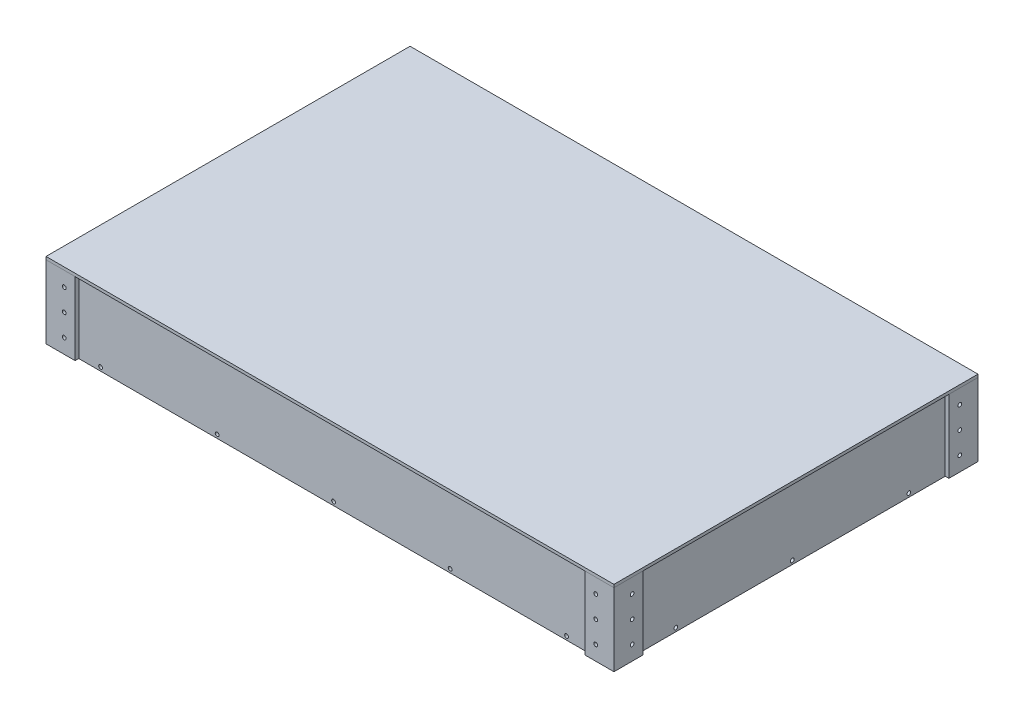
from build123d import *

# Parameters (mm, degrees)
SKETCH1_W                  = 482.6
SKETCH1_H                  = 304.8
BOSS_EXTRUDE1_DEPTH        = 6.35
BOSS_EXTRUDE2_DEPTH        = 57.15
BOSS_EXTRUDE2_DEPTH_BACK   = 6.35
SKETCH2_W                  = 482.6
SKETCH2_H                  = 3.175
BOSS_EXTRUDE2_2_DEPTH      = 57.15
BOSS_EXTRUDE2_2_DEPTH_BACK = 6.35
BOSS_EXTRUDE3_START        = -6.35
SKETCH3_W                  = 3.175
SKETCH3_H                  = 311.15
BOSS_EXTRUDE3_DEPTH        = 63.5
BOSS_EXTRUDE3_2_DEPTH      = 63.5
BOSS_EXTRUDE4_DEPTH        = 63.5
SKETCH5_R                  = 1.651
CUT_EXTRUDE1_DEPTH         = 406.170307556
SKETCH6_R                  = 1.651
CUT_EXTRUDE2_DEPTH         = 524.980822645
CUT_EXTRUDE3_DEPTH         = 406.170307556
CUT_EXTRUDE3_DEPTH_BACK    = 406.170307556
SKETCH7_R                  = 1.651
SKETCH8_R                  = 1.651
CUT_EXTRUDE4_DEPTH         = 521.980640835
SKETCH9_W                  = 495.3
SKETCH9_H                  = 317.5
BOSS_EXTRUDE5_DEPTH        = 2.54


with BuildPart() as part:
    # Sketch1 → Boss-Extrude1 (new body)
    with BuildSketch(Plane(origin=(0, 0, 0), x_dir=(1, 0, 0), z_dir=(0, 1, 0))):
        Rectangle(SKETCH1_W, SKETCH1_H)
    extrude(amount=BOSS_EXTRUDE1_DEPTH)


with BuildPart() as body_2:
    # Sketch2 → Boss-Extrude2 (new, two sides: drawn at the far end of the back side and taken through both)
    with BuildSketch(Plane(origin=(0, 6.35, 0), x_dir=(1, 0, 0), z_dir=(0, 1, 0)).offset(-BOSS_EXTRUDE2_DEPTH_BACK)):
        with Locations((0, 153.9875)):
            Rectangle(SKETCH2_W, SKETCH2_H)
    extrude(amount=BOSS_EXTRUDE2_DEPTH + BOSS_EXTRUDE2_DEPTH_BACK)


with BuildPart() as body_3:
    # Sketch2 → Boss-Extrude2 2 (new, two sides: drawn at the far end of the back side and taken through both)
    with BuildSketch(Plane(origin=(0, 6.35, 0), x_dir=(1, 0, 0), z_dir=(0, 1, 0)).offset(-BOSS_EXTRUDE2_2_DEPTH_BACK)):
        with Locations((0, -153.9875)):
            Rectangle(SKETCH2_W, SKETCH2_H)
    extrude(amount=BOSS_EXTRUDE2_2_DEPTH + BOSS_EXTRUDE2_2_DEPTH_BACK)


with BuildPart() as body_4:
    # Sketch3 → Boss-Extrude3 (new body)
    with BuildSketch(Plane(origin=(0, 6.35, 0), x_dir=(1, 0, 0), z_dir=(0, 1, 0)).offset(BOSS_EXTRUDE3_START)):
        with Locations((-242.8875, 0)):
            Rectangle(SKETCH3_W, SKETCH3_H)
    extrude(amount=BOSS_EXTRUDE3_DEPTH)


with BuildPart() as body_5:
    # Sketch3 → Boss-Extrude3 2 (new body)
    with BuildSketch(Plane(origin=(0, 6.35, 0), x_dir=(1, 0, 0), z_dir=(0, 1, 0)).offset(BOSS_EXTRUDE3_START)):
        with Locations((242.8875, 0)):
            Rectangle(SKETCH3_W, SKETCH3_H)
    extrude(amount=BOSS_EXTRUDE3_2_DEPTH)


with BuildPart() as body_6:
    # Sketch4 → Boss-Extrude4 (new body)
    with BuildSketch(Plane.XZ):
        Polygon((-244.475, -155.575), (-222.25, -155.575), (-222.25, -158.75), (-247.65, -158.75), (-247.65, -133.35), (-244.475, -133.35), align=None)
    extrude(amount=-BOSS_EXTRUDE4_DEPTH)


with BuildPart() as body_7:
    # Mirror1: mirrored copy
    add(body_6.part.mirror(Plane(origin=(0, 0, 0), x_dir=(0, 0, 1), z_dir=(1, 0, 0))))


with BuildPart() as body_8:
    # Mirror2: mirrored copy
    add(body_6.part.mirror(Plane.XY))


with BuildPart() as body_9:
    # Mirror2 2: mirrored copy
    add(body_7.part.mirror(Plane.XY))


with BuildPart() as cut_extrude1_tool:
    # Sketch5 → Cut-Extrude1 (new, through all)
    with BuildSketch(Plane(origin=(0, 0, -155.575), x_dir=(-1, 0, 0), z_dir=(0, 0, -1))):
        with Locations((-231.775, 50.8)):
            Circle(SKETCH5_R)
        with Locations((-231.775, 31.75)):
            Circle(SKETCH5_R)
        with Locations((-231.775, 12.7)):
            Circle(SKETCH5_R)
    cut_extrude1 = extrude(amount=-CUT_EXTRUDE1_DEPTH)


with BuildPart() as body_2_1:
    add(body_2.part)

    # Cut-Extrude1: cut by cut_extrude1_tool
    add(cut_extrude1_tool.part, mode=Mode.SUBTRACT)


with BuildPart() as body_3_1:
    add(body_3.part)

    # Cut-Extrude1: cut by cut_extrude1_tool
    add(cut_extrude1_tool.part, mode=Mode.SUBTRACT)


with BuildPart() as body_9_1:
    add(body_9.part)

    # Cut-Extrude1: cut by cut_extrude1_tool
    add(cut_extrude1_tool.part, mode=Mode.SUBTRACT)


with BuildPart() as mirror3_tool:
    # Mirror3: Cut-Extrude1 across plane
    add(cut_extrude1.mirror(Plane(origin=(0, 0, 0), x_dir=(0, 0, 1), z_dir=(1, 0, 0))))


with BuildPart() as body_2_2:
    add(body_2_1.part)

    # Mirror3: cut by mirror3_tool
    add(mirror3_tool.part, mode=Mode.SUBTRACT)


with BuildPart() as body_3_2:
    add(body_3_1.part)

    # Mirror3: cut by mirror3_tool
    add(mirror3_tool.part, mode=Mode.SUBTRACT)


with BuildPart() as body_8_1:
    add(body_8.part)

    # Mirror3: cut by mirror3_tool
    add(mirror3_tool.part, mode=Mode.SUBTRACT)


with BuildPart() as cut_extrude2_tool:
    # Sketch6 → Cut-Extrude2 (new, through all)
    with BuildSketch(Plane.ZY.offset(247.65)):
        with Locations((-142.875, 50.8)):
            Circle(SKETCH6_R)
        with Locations((-142.875, 31.75)):
            Circle(SKETCH6_R)
        with Locations((-142.875, 12.7)):
            Circle(SKETCH6_R)
    cut_extrude2 = extrude(amount=-CUT_EXTRUDE2_DEPTH)


with BuildPart() as body_4_1:
    add(body_4.part)

    # Cut-Extrude2: cut by cut_extrude2_tool
    add(cut_extrude2_tool.part, mode=Mode.SUBTRACT)


with BuildPart() as body_5_1:
    add(body_5.part)

    # Cut-Extrude2: cut by cut_extrude2_tool
    add(cut_extrude2_tool.part, mode=Mode.SUBTRACT)


with BuildPart() as body_6_1:
    add(body_6.part)

    # Cut-Extrude2: cut by cut_extrude2_tool
    add(cut_extrude2_tool.part, mode=Mode.SUBTRACT)


with BuildPart() as body_7_1:
    add(body_7.part)

    # Cut-Extrude2: cut by cut_extrude2_tool
    add(cut_extrude2_tool.part, mode=Mode.SUBTRACT)


with BuildPart() as mirror4_tool:
    # Mirror4: Cut-Extrude2 across plane
    add(cut_extrude2.mirror(Plane.XY))


with BuildPart() as body_4_2:
    add(body_4_1.part)

    # Mirror4: cut by mirror4_tool
    add(mirror4_tool.part, mode=Mode.SUBTRACT)


with BuildPart() as body_5_2:
    add(body_5_1.part)

    # Mirror4: cut by mirror4_tool
    add(mirror4_tool.part, mode=Mode.SUBTRACT)


with BuildPart() as body_8_2:
    add(body_8_1.part)

    # Mirror4: cut by mirror4_tool
    add(mirror4_tool.part, mode=Mode.SUBTRACT)


with BuildPart() as body_9_2:
    add(body_9_1.part)

    # Mirror4: cut by mirror4_tool
    add(mirror4_tool.part, mode=Mode.SUBTRACT)


with BuildPart() as cut_extrude3_tool:
    # Sketch7 → Cut-Extrude3 (new, two sides: drawn at the far end of the back side and taken through both)
    with BuildSketch(Plane.XY.offset(155.575).offset(-CUT_EXTRUDE3_DEPTH_BACK)):
        with Locations((-203.2, 3.175)):
            Circle(SKETCH7_R)
        with Locations((0, 3.175)):
            Circle(SKETCH7_R)
        with Locations((203.2, 3.175)):
            Circle(SKETCH7_R)
        with Locations((101.6, 3.175)):
            Circle(SKETCH7_R)
        with Locations((-101.6, 3.175)):
            Circle(SKETCH7_R)
    extrude(amount=CUT_EXTRUDE3_DEPTH + CUT_EXTRUDE3_DEPTH_BACK)


with BuildPart() as body_3_3:
    add(body_3_2.part)

    # Cut-Extrude3: cut by cut_extrude3_tool
    add(cut_extrude3_tool.part, mode=Mode.SUBTRACT)


with BuildPart() as body_2_3:
    add(body_2_2.part)

    # Cut-Extrude3: cut by cut_extrude3_tool
    add(cut_extrude3_tool.part, mode=Mode.SUBTRACT)


with BuildPart() as cut_extrude4_tool:
    # Sketch8 → Cut-Extrude4 (new, through all)
    with BuildSketch(Plane(origin=(244.475, 0, 0), x_dir=(0, 0, -1), z_dir=(1, 0, 0))):
        with Locations((0, 3.175)):
            Circle(SKETCH8_R)
        with Locations((101.6, 3.175)):
            Circle(SKETCH8_R)
        with Locations((-101.6, 3.175)):
            Circle(SKETCH8_R)
    extrude(amount=-CUT_EXTRUDE4_DEPTH)


with BuildPart() as body_5_3:
    add(body_5_2.part)

    # Cut-Extrude4: cut by cut_extrude4_tool
    add(cut_extrude4_tool.part, mode=Mode.SUBTRACT)


with BuildPart() as body_4_3:
    add(body_4_2.part)

    # Cut-Extrude4: cut by cut_extrude4_tool
    add(cut_extrude4_tool.part, mode=Mode.SUBTRACT)


with BuildPart() as body_10:
    # Sketch9 → Boss-Extrude5 (new body)
    with BuildSketch(Plane(origin=(0, 63.5, 0), x_dir=(1, 0, 0), z_dir=(0, 1, 0))):
        Rectangle(SKETCH9_W, SKETCH9_H)
    extrude(amount=BOSS_EXTRUDE5_DEPTH)


solid = Compound([part.part, body_6_1.part, body_7_1.part, body_8_2.part, body_9_2.part, body_3_3.part, body_2_3.part, body_5_3.part, body_4_3.part, body_10.part])
